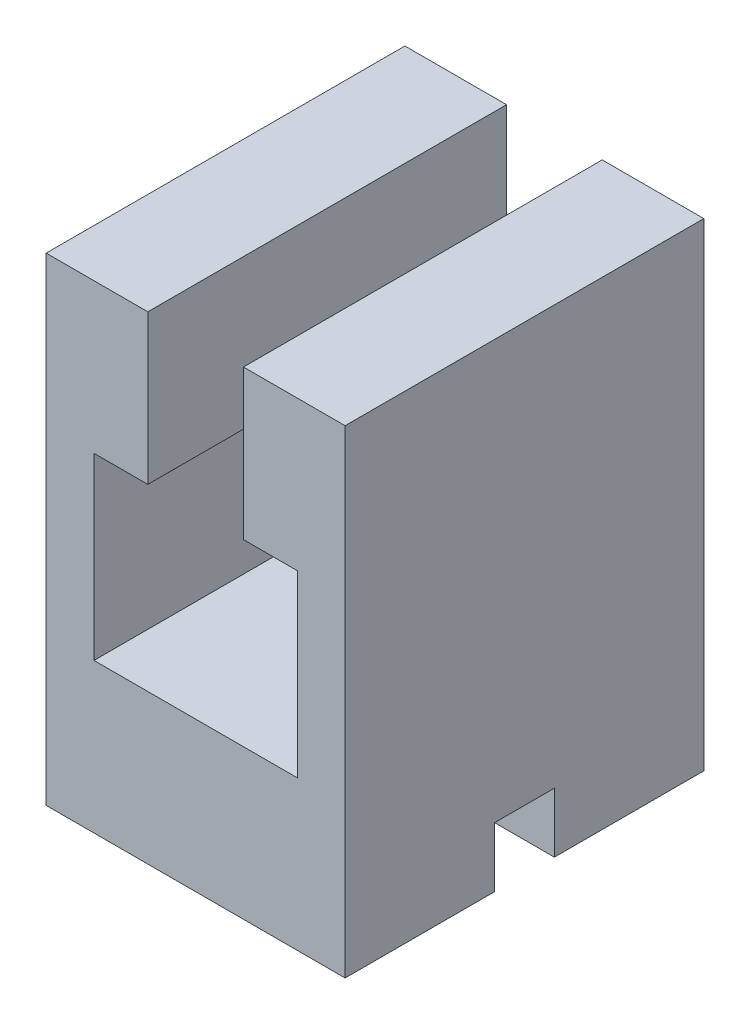
from build123d import *

# Parameters (mm, degrees)
BOSS_EXTRUDE2_DEPTH = 60
SKETCH2_W           = 10
SKETCH2_H           = 10
CUT_EXTRUDE1_DEPTH  = 60


with BuildPart() as part:
    # Sketch1 → Boss-Extrude2 (new body)
    with BuildSketch(Plane.XY):
        Polygon((-50.540381022, -30.675149326), (-0.540381022, -30.675149326), (-0.540381022, 49.324850674), (-17.540381022, 49.324850674), (-17.540381022, 24.324850674), (-8.540381022, 24.324850674), (-8.540381022, -5.675149326), (-42.540381022, -5.675149326), (-42.540381022, 24.324850674), (-33.540381022, 24.324850674), (-33.540381022, 49.324850674), (-50.540381022, 49.324850674), align=None)
    extrude(amount=BOSS_EXTRUDE2_DEPTH)

    # Sketch2 → Cut-Extrude1 (cut)
    with BuildSketch(Plane.ZY.offset(50.540381022)):
        with Locations((30, -25.675149326)):
            Rectangle(SKETCH2_W, SKETCH2_H)
    extrude(amount=-CUT_EXTRUDE1_DEPTH, mode=Mode.SUBTRACT)


solid = part.part
